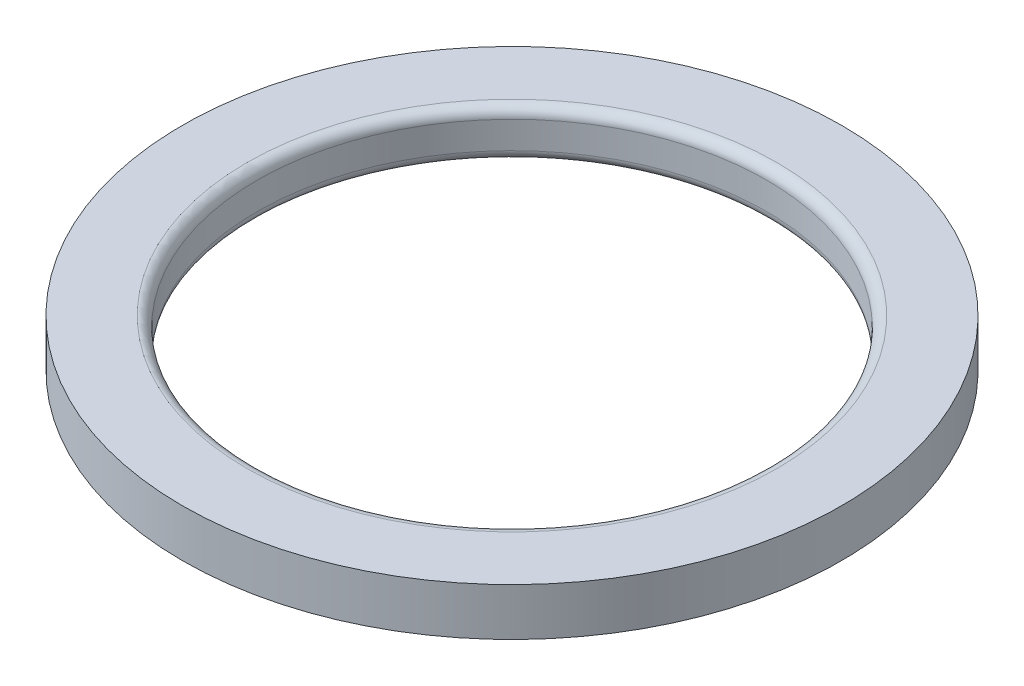
from build123d import *

# Parameters (mm, degrees)
SKETCH1_R           = 9.7
SKETCH1_R_2         = 7.5
BOSS_EXTRUDE1_DEPTH = 1.4
FILLET1_R           = 0.3


with BuildPart() as part:
    # Sketch1 → Boss-Extrude1 (new body)
    with BuildSketch(Plane(origin=(0, 0, 0), x_dir=(1, 0, 0), z_dir=(0, 1, 0))):
        with Locations(Location((0, 0, 0), (0, 0, 270))):
            Circle(SKETCH1_R)
        with Locations(Location((0, 0, 0), (0, 0, 270))):
            Circle(SKETCH1_R_2, mode=Mode.SUBTRACT)
    extrude(amount=BOSS_EXTRUDE1_DEPTH)

    # Fillet1
    fillet1_edges = [part.edges().sort_by_distance(p)[0] for p in [
        (0, 0, -7.5),
        (0, 1.4, -7.5),
    ]]
    fillet(fillet1_edges, radius=FILLET1_R)


solid = part.part
